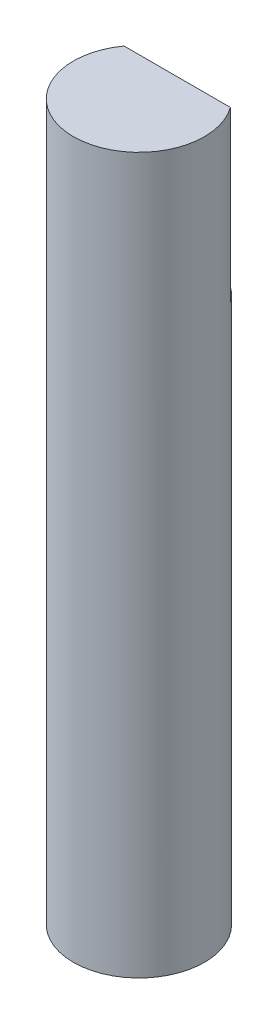
from build123d import *

# Parameters (mm, degrees)
SKETCH1_R           = 3.85
BOSS_EXTRUDE1_DEPTH = 42
CUT_EXTRUDE1_START  = -10
CUT_EXTRUDE1_DEPTH  = 10


with BuildPart() as part:
    # Sketch1 → Boss-Extrude1 (new body)
    with BuildSketch(Plane(origin=(0, 0, 0), x_dir=(1, 0, 0), z_dir=(0, 1, 0))):
        with Locations(Location((0, 0, 0), (0, 0, 90))):
            Circle(SKETCH1_R)
    extrude(amount=BOSS_EXTRUDE1_DEPTH)

    # Sketch2 → Cut-Extrude1 (cut)
    with BuildSketch(Plane(origin=(0, 42, 0), x_dir=(1, 0, 0), z_dir=(0, 1, 0)).offset(CUT_EXTRUDE1_START)):
        with BuildLine():
            Line((-3.12409987, 2.25), (3.12409987, 2.25))
            ThreePointArc((3.12409987, 2.25), (0, 3.85), (-3.12409987, 2.25))
        make_face()
    extrude(amount=CUT_EXTRUDE1_DEPTH, mode=Mode.SUBTRACT)


solid = part.part
